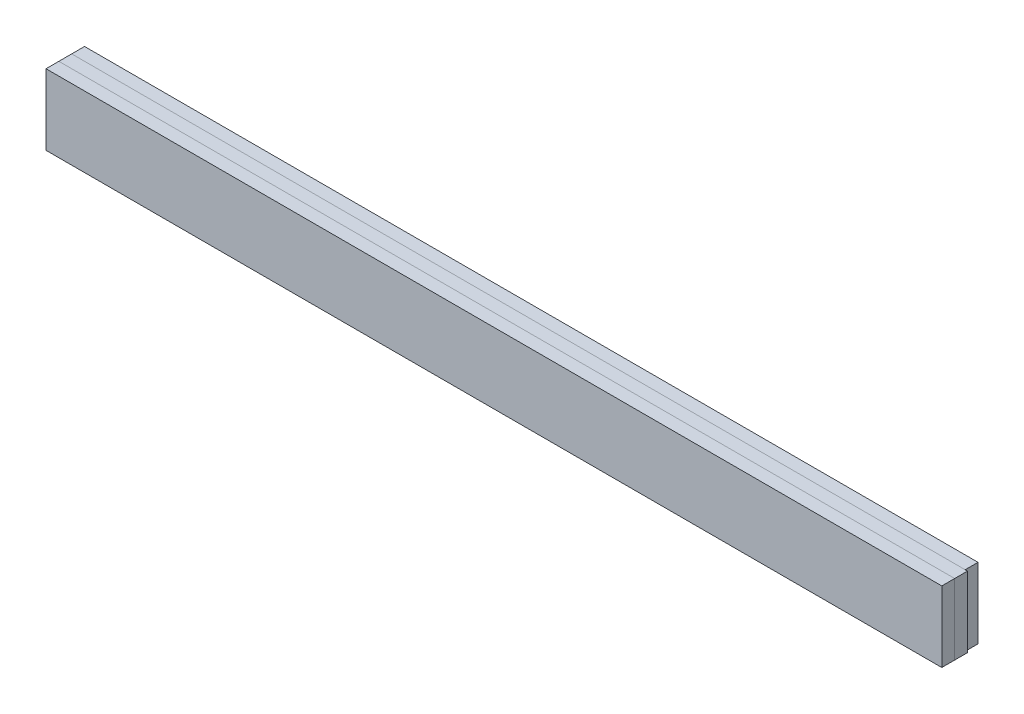
from build123d import *

# Parameters (mm, degrees)
SKETCH1_W           = 69.7
SKETCH1_H           = 5.5
BOSS_EXTRUDE1_DEPTH = 0.5
SKETCH2_W           = 69.7
SKETCH2_H           = 5.5
BOSS_EXTRUDE2_DEPTH = 1
SKETCH3_W           = 69.517480874
SKETCH3_H           = 5.5
BOSS_EXTRUDE3_DEPTH = 1


with BuildPart() as part:
    # Sketch1 → Boss-Extrude1 (new, symmetric)
    with BuildSketch(Plane.XY):
        with Locations((0, 2.75)):
            Rectangle(SKETCH1_W, SKETCH1_H)
    extrude(amount=BOSS_EXTRUDE1_DEPTH, both=True)


with BuildPart() as body_2:
    # Sketch2 → Boss-Extrude2 (new body)
    with BuildSketch(Plane.XY.offset(0.5)):
        with Locations((0, 2.75)):
            Rectangle(SKETCH2_W, SKETCH2_H)
    extrude(amount=BOSS_EXTRUDE2_DEPTH)


with BuildPart() as body_3:
    # Sketch3 → Boss-Extrude3 (new body)
    with BuildSketch(Plane(origin=(0, 0, -0.5), x_dir=(-1, 0, 0), z_dir=(0, 0, -1))):
        with Locations((0.091259563, 2.75)):
            Rectangle(SKETCH3_W, SKETCH3_H)
    extrude(amount=BOSS_EXTRUDE3_DEPTH)


solid = Compound([part.part, body_2.part, body_3.part])
